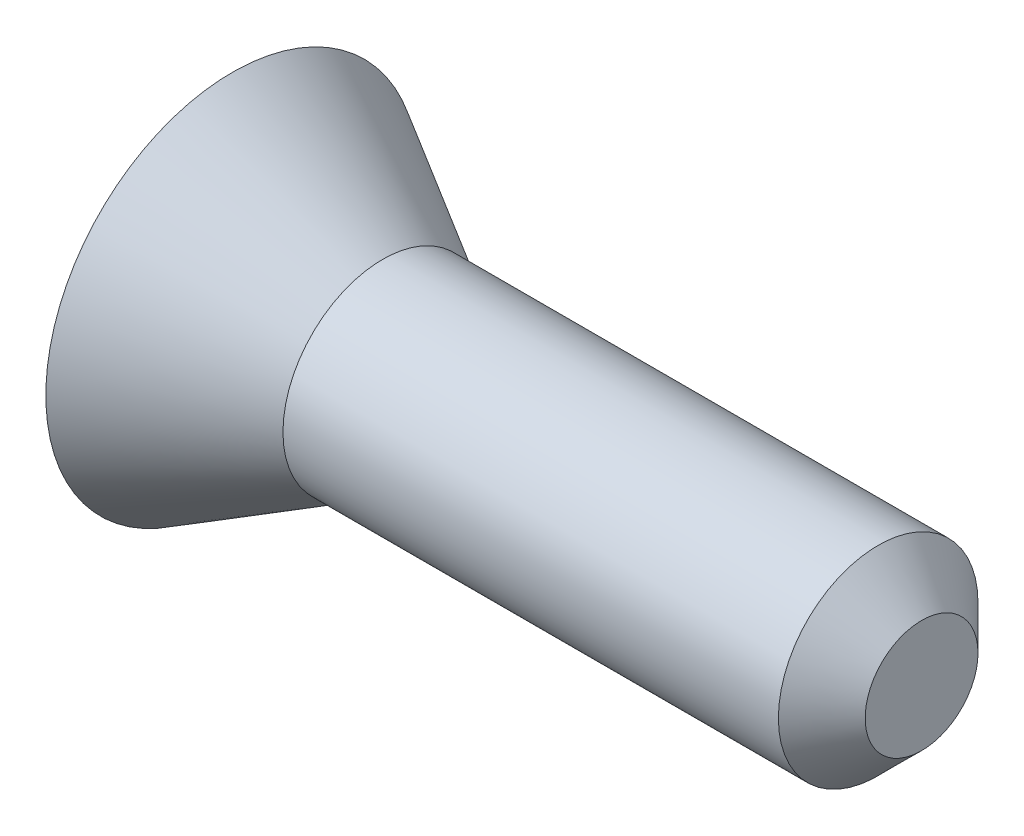
from build123d import *

# Parameters (mm, degrees)
CUT_EXTRUDE1_REACH = 11.045


with BuildPart() as part:
    # Sketch1 → Revolve1 (revolve)
    with BuildSketch(Plane.XY, mode=Mode.PRIVATE) as revolve1_sk:
        Polygon((0, 2.730499999), (0, 0), (10.0838, 0), (10.0838, 0.825499999), (9.4488, 1.460499999), (2.199704525, 1.460499999), align=None)
    revolve(revolve1_sk.sketch.rotate(Axis((0, 0, 0), (1, 0, 0)), 270), axis=Axis((0, 0, 0), (1, 0, 0)))

    # Sketch2 → Cut-Extrude1 (cut, up to next)
    with BuildSketch(Plane(origin=(1.905, 0, 0), x_dir=(0, 0, -1), z_dir=(1, 0, 0)), mode=Mode.PRIVATE) as cut_extrude1_sk1:
        Polygon((0.3429, 1.524), (-0.3429, 1.524), (-0.3429, 0.3429), (-1.524, 0.3429), (-1.524, -0.3429), (-0.3429, -0.3429), (-0.3429, -1.524), (0.3429, -1.524), (0.3429, -0.3429), (1.524, -0.3429), (1.524, 0.3429), (0.3429, 0.3429), align=None)
    cut_extrude1_tool1 = extrude(cut_extrude1_sk1.sketch, amount=-CUT_EXTRUDE1_REACH, mode=Mode.PRIVATE) & part.part
    add(cut_extrude1_tool1.solids().sort_by_distance((1.905, 0, 0))[0], mode=Mode.SUBTRACT)


solid = part.part
